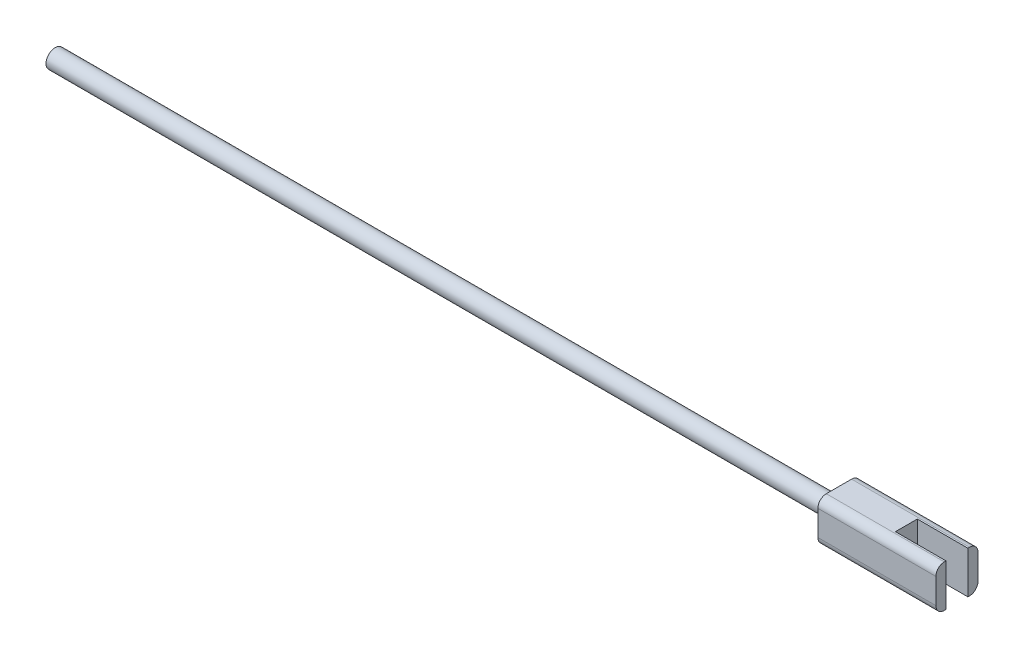
from build123d import *

# Parameters (mm, degrees)
SKETCH1_R               = 1.09
BOSS_EXTRUDE1_DEPTH     = 95.007
BOSS_EXTRUDE2_DEPTH     = 14
CUT_EXTRUDE1_DEPTH      = 108.065391462
CUT_EXTRUDE1_DEPTH_BACK = 108.065391462
SKETCH3_W               = 7
SKETCH3_H               = 2.6


with BuildPart() as part:
    # Sketch1 → Boss-Extrude1 (new body)
    with BuildSketch(Plane(origin=(0, 0, 0), x_dir=(0, 0, -1), z_dir=(1, 0, 0))):
        Circle(SKETCH1_R)
    extrude(amount=BOSS_EXTRUDE1_DEPTH)

    # Sketch2 → Boss-Extrude2 (add)
    with BuildSketch(Plane(origin=(93.007, 0, 0), x_dir=(0, 0, -1), z_dir=(1, 0, 0))):
        with BuildLine():
            Line((-1.5, -2.5), (1.5, -2.5))
            ThreePointArc((1.5, -2.5), (2.207106781, -2.207106781), (2.5, -1.5))
            Line((2.5, -1.5), (2.5, 1.5))
            ThreePointArc((2.5, 1.5), (2.207106781, 2.207106781), (1.5, 2.5))
            Line((1.5, 2.5), (-1.5, 2.5))
            ThreePointArc((-1.5, 2.5), (-2.207106781, 2.207106781), (-2.5, 1.5))
            Line((-2.5, 1.5), (-2.5, -1.5))
            ThreePointArc((-2.5, -1.5), (-2.207106781, -2.207106781), (-1.5, -2.5))
        make_face()
    extrude(amount=BOSS_EXTRUDE2_DEPTH)

    # Sketch3 → Cut-Extrude1 (cut, two sides: drawn at the far end of the back side and taken through both)
    with BuildSketch(Plane(origin=(0, 0, 0), x_dir=(1, 0, 0), z_dir=(0, 1, 0)).offset(-CUT_EXTRUDE1_DEPTH_BACK)):
        with Locations((104.507, 0)):
            Rectangle(SKETCH3_W, SKETCH3_H)
    extrude(amount=CUT_EXTRUDE1_DEPTH + CUT_EXTRUDE1_DEPTH_BACK, mode=Mode.SUBTRACT)


solid = part.part
